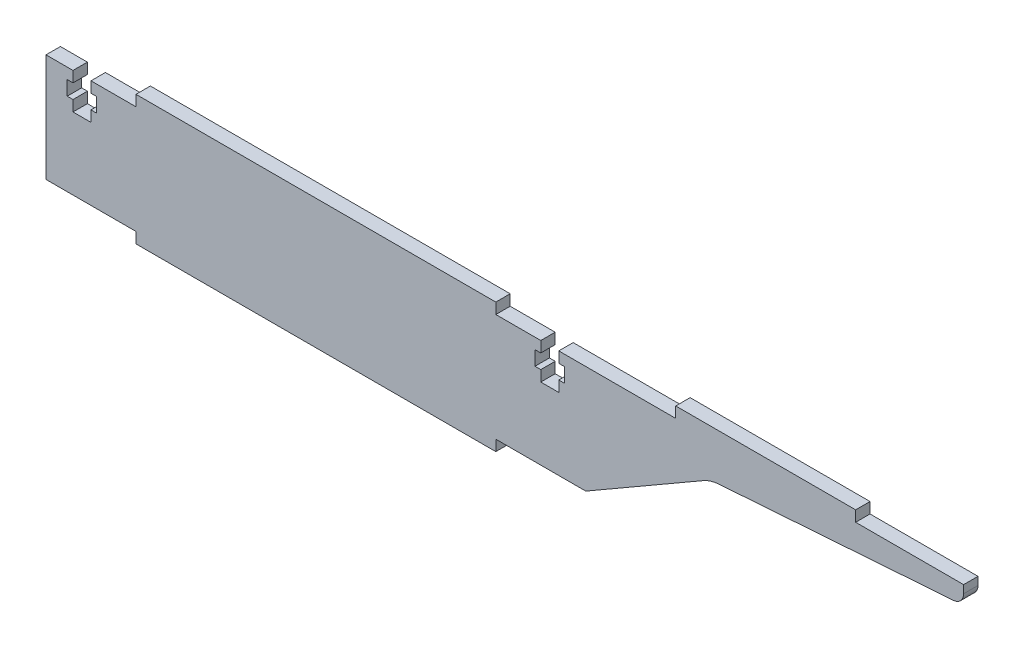
from build123d import *

# Parameters (mm, degrees)
SKETCH1_W           = 150
SKETCH1_H           = 30
SKETCH1_W_2         = 100
SKETCH1_H_2         = 6
BOSS_EXTRUDE1_DEPTH = 4
SKETCH2_W           = 5
SKETCH2_H           = 20
SKETCH2_W_2         = 8.2
SKETCH2_H_2         = 4
CUT_EXTRUDE1_DEPTH  = 10
SKETCH3_W           = 50
SKETCH3_H           = 3
BOSS_EXTRUDE2_DEPTH = 4


with BuildPart() as part:
    # Sketch1 → Boss-Extrude1 (new body)
    with BuildSketch(Plane.XY):
        Rectangle(SKETCH1_W, SKETCH1_H)
        with Locations((0, -15)):
            Rectangle(SKETCH1_W_2, SKETCH1_H_2)
        with Locations((0, 15)):
            Rectangle(SKETCH1_W_2, SKETCH1_H_2)
    extrude(amount=BOSS_EXTRUDE1_DEPTH)

    # Sketch2 → Cut-Extrude1 (cut)
    with BuildSketch(Plane.XY.offset(4)):
        with Locations((-65, 15)):
            Rectangle(SKETCH2_W, SKETCH2_H)
        with Locations((-65, 10)):
            Rectangle(SKETCH2_W_2, SKETCH2_H_2)
    cut_extrude1 = extrude(amount=-CUT_EXTRUDE1_DEPTH, mode=Mode.SUBTRACT)

    # Mirror1: Cut-Extrude1 across plane
    add(cut_extrude1.mirror(Plane(origin=(0, 0, 0), x_dir=(0, 0, 1), z_dir=(1, 0, 0))), mode=Mode.SUBTRACT)

    # Sketch3 → Boss-Extrude2 (add)
    with BuildSketch(Plane.XY.offset(4)):
        with BuildLine():
            ThreePointArc((180, 12.794373235), (179.195218474, 10.749619986), (177.212656099, 9.80191983))
            Line((177.212656099, 9.80191983), (111.937946201, 5.163229336))
            ThreePointArc((111.937946201, 5.163229336), (109.717672062, 4.749776304), (107.646799864, 3.84863869))
            Line((107.646799864, 3.84863869), (75, -15))
            Line((75, -15), (75, 15))
            Line((75, 15), (180, 15))
            Line((180, 15), (180, 12.794373235))
        make_face()
        with Locations((125, 16.5)):
            Rectangle(SKETCH3_W, SKETCH3_H)
    extrude(amount=-BOSS_EXTRUDE2_DEPTH)


solid = part.part
